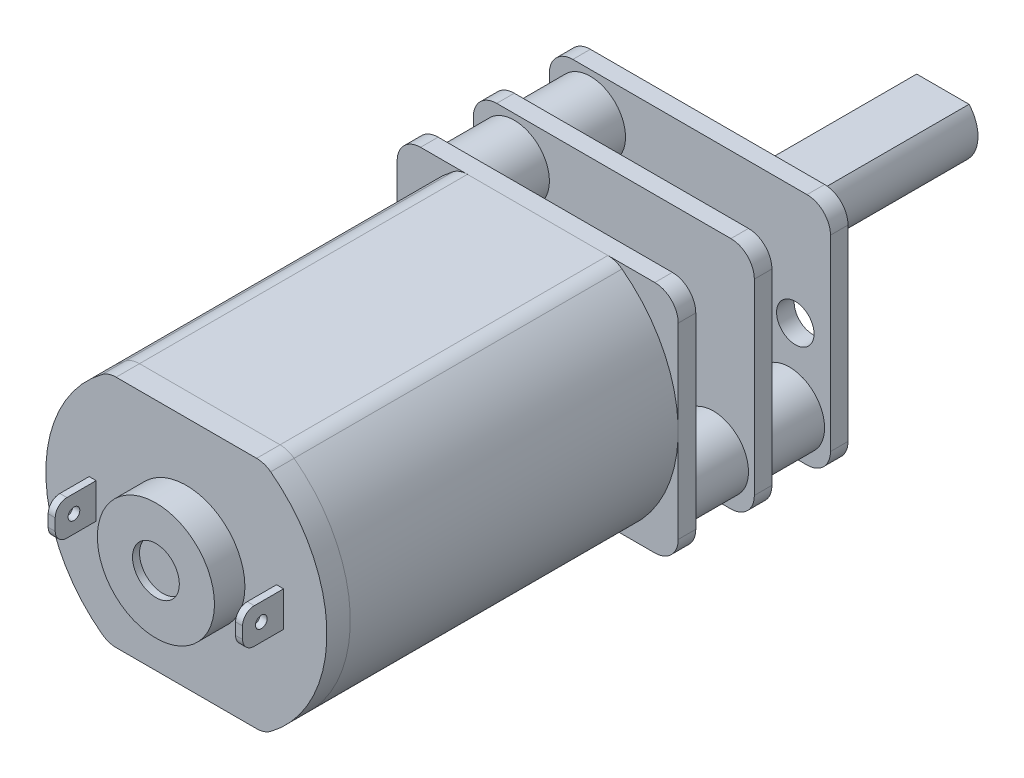
from build123d import *

# Parameters (mm, degrees)
BOSS_EXTRUDE1_DEPTH   = 14
FILLET1_R             = 1
BOSS_EXTRUDE2_DEPTH   = 1
SKETCH3_R             = 2.5
BOSS_EXTRUDE3_DEPTH   = 1.3
SKETCH4_R             = 1
CUT_EXTRUDE1_DEPTH    = 0.3
SKETCH5_W             = 0.3
SKETCH5_H             = 1.5
BOSS_EXTRUDE4_DEPTH   = 1.75
FILLET2_R             = 0.5
SKETCH6_R             = 0.25
CUT_EXTRUDE2_DEPTH    = 0.3
SKETCH7_R             = 0.25
CUT_EXTRUDE3_DEPTH    = 0.3
SKETCH8_W             = 12
SKETCH8_H             = 10
BOSS_EXTRUDE5_DEPTH   = 0.75
SKETCH9_W             = 12
SKETCH9_H             = 10
BOSS_EXTRUDE6_DEPTH   = 0.75
SKETCH10_W            = 12
SKETCH10_H            = 10
BOSS_EXTRUDE7_DEPTH   = 0.75
BOSS_EXTRUDE8_START   = -0.3
SKETCH11_R            = 1.5
BOSS_EXTRUDE8_DEPTH   = 6.2
BOSS_EXTRUDE8_2_DEPTH = 6.2
FILLET3_R             = 1
FILLET4_R             = 1
FILLET5_R             = 1
SKETCH12_R            = 2
BOSS_EXTRUDE9_DEPTH   = 0.8
SKETCH13_R            = 1.5
BOSS_EXTRUDE10_DEPTH  = 9.25
SKETCH14_W            = 9.25
SKETCH14_H            = 3
CUT_EXTRUDE4_DEPTH    = 0.5
CUT_EXTRUDE5_DEPTH    = 0.25
SKETCH16_R            = 1.5
CUT_EXTRUDE6_DEPTH    = 0.05
SKETCH17_R            = 0.8
CUT_EXTRUDE7_DEPTH    = 0.75


with BuildPart() as part:
    # Sketch1 → Boss-Extrude1 (new body)
    with BuildSketch(Plane.XY):
        with BuildLine():
            Line((-3.31662479, -5), (3.31662479, -5))
            ThreePointArc((3.31662479, -5), (6, 0), (3.31662479, 5))
            Line((3.31662479, 5), (-3.31662479, 5))
            ThreePointArc((-3.31662479, 5), (-6, 0), (-3.31662479, -5))
        make_face()
    extrude(amount=-BOSS_EXTRUDE1_DEPTH)

    # Fillet1
    fillet1_edges = [part.edges().sort_by_distance(p)[0] for p in [
        (3.31662479, -5, -7),
        (-3.31662479, -5, -7),
        (-3.31662479, 5, -7),
        (3.31662479, 5, -7),
    ]]
    fillet(fillet1_edges, radius=FILLET1_R)


with BuildPart() as body_2:
    # Sketch2 → Boss-Extrude2 (new body)
    with BuildSketch(Plane.XY):
        with BuildLine():
            Line((-3, -5), (3, -5))
            ThreePointArc((3, -5), (3.316227766, -4.948683298), (3.6, -4.8))
            ThreePointArc((3.6, -4.8), (6, 0), (3.6, 4.8))
            ThreePointArc((3.6, 4.8), (3.316227766, 4.948683298), (3, 5))
            Line((3, 5), (-3, 5))
            ThreePointArc((-3, 5), (-3.316227766, 4.948683298), (-3.6, 4.8))
            ThreePointArc((-3.6, 4.8), (-6, 0), (-3.6, -4.8))
            ThreePointArc((-3.6, -4.8), (-3.316227766, -4.948683298), (-3, -5))
        make_face()
    extrude(amount=BOSS_EXTRUDE2_DEPTH)

    # Sketch3 → Boss-Extrude3 (add)
    with BuildSketch(Plane.XY.offset(1)):
        Circle(SKETCH3_R)
    extrude(amount=BOSS_EXTRUDE3_DEPTH)

    # Sketch4 → Cut-Extrude1 (cut)
    with BuildSketch(Plane.XY.offset(2.3)):
        Circle(SKETCH4_R)
    extrude(amount=-CUT_EXTRUDE1_DEPTH, mode=Mode.SUBTRACT)

    # Sketch5 → Boss-Extrude4 (add)
    with BuildSketch(Plane.XY.offset(1)):
        with Locations((-4, 0)):
            Rectangle(SKETCH5_W, SKETCH5_H)
        with Locations((4, 0)):
            Rectangle(SKETCH5_W, SKETCH5_H)
    extrude(amount=BOSS_EXTRUDE4_DEPTH)

    # Fillet2
    fillet2_edges = [body_2.edges().sort_by_distance(p)[0] for p in [
        (-4, 0.75, 2.75),
        (-4, -0.75, 2.75),
        (4, 0.75, 2.75),
        (4, -0.75, 2.75),
    ]]
    fillet(fillet2_edges, radius=FILLET2_R)

    # Sketch6 → Cut-Extrude2 (cut)
    with BuildSketch(Plane.ZY.offset(4.15)):
        with Locations((1.95, 0)):
            Circle(SKETCH6_R)
    extrude(amount=-CUT_EXTRUDE2_DEPTH, mode=Mode.SUBTRACT)

    # Sketch7 → Cut-Extrude3 (cut)
    with BuildSketch(Plane(origin=(4.15, 0, 0), x_dir=(0, 0, -1), z_dir=(1, 0, 0))):
        with Locations(Location((-1.95, 0, 0), (0, 0, 180))):
            Circle(SKETCH7_R)
    extrude(amount=-CUT_EXTRUDE3_DEPTH, mode=Mode.SUBTRACT)


with BuildPart() as body_3:
    # Sketch8 → Boss-Extrude5 (new body)
    with BuildSketch(Plane(origin=(0, 0, -14), x_dir=(-1, 0, 0), z_dir=(0, 0, -1))):
        Rectangle(SKETCH8_W, SKETCH8_H)
    extrude(amount=BOSS_EXTRUDE5_DEPTH)

    # Fillet5
    fillet5_edges = [body_3.edges().sort_by_distance(p)[0] for p in [
        (6, 5, -14.375),
        (-6, 5, -14.375),
        (-6, -5, -14.375),
        (6, -5, -14.375),
    ]]
    fillet(fillet5_edges, radius=FILLET5_R)


with BuildPart() as body_4:
    # Sketch9 → Boss-Extrude6 (new body)
    with BuildSketch(Plane(origin=(0, 0, -17.25), x_dir=(-1, 0, 0), z_dir=(0, 0, -1))):
        Rectangle(SKETCH9_W, SKETCH9_H)
    extrude(amount=BOSS_EXTRUDE6_DEPTH)

    # Fillet4
    fillet4_edges = [body_4.edges().sort_by_distance(p)[0] for p in [
        (-6, 5, -17.625),
        (-6, -5, -17.625),
        (6, -5, -17.625),
        (6, 5, -17.625),
    ]]
    fillet(fillet4_edges, radius=FILLET4_R)


with BuildPart() as body_5:
    # Sketch10 → Boss-Extrude7 (new body)
    with BuildSketch(Plane(origin=(0, 0, -20.5), x_dir=(-1, 0, 0), z_dir=(0, 0, -1))):
        Rectangle(SKETCH10_W, SKETCH10_H)
    extrude(amount=BOSS_EXTRUDE7_DEPTH)

    # Fillet3
    fillet3_edges = [body_5.edges().sort_by_distance(p)[0] for p in [
        (-6, -5, -20.875),
        (6, -5, -20.875),
        (6, 5, -20.875),
        (-6, 5, -20.875),
    ]]
    fillet(fillet3_edges, radius=FILLET3_R)

    # Sketch12 → Boss-Extrude9 (add)
    with BuildSketch(Plane(origin=(0, 0, -21.25), x_dir=(-1, 0, 0), z_dir=(0, 0, -1))):
        Circle(SKETCH12_R)
    extrude(amount=BOSS_EXTRUDE9_DEPTH)

    # Sketch13 → Boss-Extrude10 (add)
    with BuildSketch(Plane(origin=(0, 0, -22.05), x_dir=(-1, 0, 0), z_dir=(0, 0, -1))):
        Circle(SKETCH13_R)
    extrude(amount=BOSS_EXTRUDE10_DEPTH)

    # Sketch14 → Cut-Extrude4 (cut)
    with BuildSketch(Plane.ZX.offset(1.5)):
        with Locations((-26.675, 0)):
            Rectangle(SKETCH14_W, SKETCH14_H)
    extrude(amount=-CUT_EXTRUDE4_DEPTH, mode=Mode.SUBTRACT)

    # Sketch15 → Cut-Extrude5 (cut)
    with BuildSketch(Plane(origin=(0, 0, -21.25), x_dir=(-1, 0, 0), z_dir=(0, 0, -1))):
        with BuildLine():
            ThreePointArc((4.45, 4.736606875), (4.25, 4.75), (4.05, 4.736606875))
            Line((4.05, 4.736606875), (4.05, 3.65))
            ThreePointArc((4.05, 3.65), (3.991421356, 3.508578644), (3.85, 3.45))
            Line((3.85, 3.45), (2.763393125, 3.45))
            ThreePointArc((2.763393125, 3.45), (2.75, 3.25), (2.763393125, 3.05))
            Line((2.763393125, 3.05), (3.85, 3.05))
            ThreePointArc((3.85, 3.05), (3.991421356, 2.991421356), (4.05, 2.85))
            Line((4.05, 2.85), (4.05, 1.763393125))
            ThreePointArc((4.05, 1.763393125), (4.25, 1.75), (4.45, 1.763393125))
            Line((4.45, 1.763393125), (4.45, 2.85))
            ThreePointArc((4.45, 2.85), (4.508578644, 2.991421356), (4.65, 3.05))
            Line((4.65, 3.05), (5.736606875, 3.05))
            ThreePointArc((5.736606875, 3.05), (5.746647973, 3.149776031), (5.75, 3.25))
            ThreePointArc((5.75, 3.25), (5.746647973, 3.350223969), (5.736606875, 3.45))
            Line((5.736606875, 3.45), (4.65, 3.45))
            ThreePointArc((4.65, 3.45), (4.508578644, 3.508578644), (4.45, 3.65))
            Line((4.45, 3.65), (4.45, 4.736606875))
        make_face()
        with BuildLine():
            ThreePointArc((-4.05, -1.763393125), (-4.25, -1.75), (-4.45, -1.763393125))
            Line((-4.45, -1.763393125), (-4.45, -2.85))
            ThreePointArc((-4.45, -2.85), (-4.508578644, -2.991421356), (-4.65, -3.05))
            Line((-4.65, -3.05), (-5.736606875, -3.05))
            ThreePointArc((-5.736606875, -3.05), (-5.75, -3.25), (-5.736606875, -3.45))
            Line((-5.736606875, -3.45), (-4.65, -3.45))
            ThreePointArc((-4.65, -3.45), (-4.508578644, -3.508578644), (-4.45, -3.65))
            Line((-4.45, -3.65), (-4.45, -4.736606875))
            ThreePointArc((-4.45, -4.736606875), (-4.25, -4.75), (-4.05, -4.736606875))
            Line((-4.05, -4.736606875), (-4.05, -3.65))
            ThreePointArc((-4.05, -3.65), (-3.991421356, -3.508578644), (-3.85, -3.45))
            Line((-3.85, -3.45), (-2.763393125, -3.45))
            ThreePointArc((-2.763393125, -3.45), (-2.753352027, -3.350223969), (-2.75, -3.25))
            ThreePointArc((-2.75, -3.25), (-2.753352027, -3.149776031), (-2.763393125, -3.05))
            Line((-2.763393125, -3.05), (-3.85, -3.05))
            ThreePointArc((-3.85, -3.05), (-3.991421356, -2.991421356), (-4.05, -2.85))
            Line((-4.05, -2.85), (-4.05, -1.763393125))
        make_face()
    extrude(amount=-CUT_EXTRUDE5_DEPTH, mode=Mode.SUBTRACT)

    # Sketch16 → Cut-Extrude6 (cut)
    with BuildSketch(Plane(origin=(0, 0, -21.25), x_dir=(-1, 0, 0), z_dir=(0, 0, -1))):
        with Locations((4.25, 3.25)):
            Circle(SKETCH16_R)
        with Locations((-4.25, -3.25)):
            Circle(SKETCH16_R)
    extrude(amount=-CUT_EXTRUDE6_DEPTH, mode=Mode.SUBTRACT)

    # Sketch17 → Cut-Extrude7 (cut)
    with BuildSketch(Plane(origin=(0, 0, -21.25), x_dir=(-1, 0, 0), z_dir=(0, 0, -1))):
        with Locations((-4.5, 0)):
            Circle(SKETCH17_R)
        with Locations((4.5, 0)):
            Circle(SKETCH17_R)
    extrude(amount=-CUT_EXTRUDE7_DEPTH, mode=Mode.SUBTRACT)


with BuildPart() as body_6:
    # Sketch11 → Boss-Extrude8 (new body)
    with BuildSketch(Plane(origin=(0, 0, -21.25), x_dir=(-1, 0, 0), z_dir=(0, 0, -1)).offset(BOSS_EXTRUDE8_START)):
        with Locations((4.25, 3.25)):
            Circle(SKETCH11_R)
    extrude(amount=-BOSS_EXTRUDE8_DEPTH)


with BuildPart() as body_7:
    # Sketch11 → Boss-Extrude8 2 (new body)
    with BuildSketch(Plane(origin=(0, 0, -21.25), x_dir=(-1, 0, 0), z_dir=(0, 0, -1)).offset(BOSS_EXTRUDE8_START)):
        with Locations((-4.25, -3.25)):
            Circle(SKETCH11_R)
    extrude(amount=-BOSS_EXTRUDE8_2_DEPTH)


solid = Compound([part.part, body_2.part, body_3.part, body_4.part, body_5.part, body_6.part, body_7.part])
